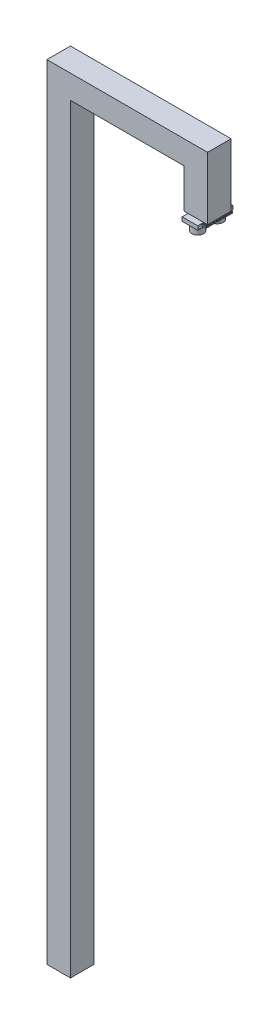
from build123d import *

# Parameters (mm, degrees)
SKETCH1_W           = 3
SKETCH1_H           = 3
BOSS_EXTRUDE1_DEPTH = 100
SKETCH3_W           = 3
SKETCH3_H           = 3
BOSS_EXTRUDE2_DEPTH = 17.5
SKETCH4_W           = 3
SKETCH4_H           = 3
BOSS_EXTRUDE3_DEPTH = 5
SKETCH5_W           = 2
SKETCH5_H           = 4.5
BOSS_EXTRUDE4_DEPTH = 0.5
SKETCH6_R           = 0.75
BOSS_EXTRUDE5_DEPTH = 1
SKETCH7_W           = 0.044871795
SKETCH7_H           = 0.25
BOSS_EXTRUDE6_DEPTH = 0.5


with BuildPart() as part:
    # Sketch1 → Boss-Extrude1 (new body)
    with BuildSketch(Plane(origin=(0, 0, 0), x_dir=(1, 0, 0), z_dir=(0, 1, 0))):
        Rectangle(SKETCH1_W, SKETCH1_H)
    extrude(amount=BOSS_EXTRUDE1_DEPTH)

    # Sketch3 → Boss-Extrude2 (add)
    with BuildSketch(Plane(origin=(1.5, 0, 0), x_dir=(0, 0, -1), z_dir=(1, 0, 0))):
        with Locations((0, 98.5)):
            Rectangle(SKETCH3_W, SKETCH3_H)
    extrude(amount=BOSS_EXTRUDE2_DEPTH)

    # Sketch4 → Boss-Extrude3 (add)
    with BuildSketch(Plane.XZ.offset(-97)):
        with Locations((17.5, 0)):
            Rectangle(SKETCH4_W, SKETCH4_H)
    extrude(amount=BOSS_EXTRUDE3_DEPTH)

    # Sketch5 → Boss-Extrude4 (add)
    with BuildSketch(Plane.XZ.offset(-92)):
        with Locations((17.5, 0)):
            Rectangle(SKETCH5_W, SKETCH5_H)
    extrude(amount=BOSS_EXTRUDE4_DEPTH)

    # Sketch6 → Boss-Extrude5 (add)
    with BuildSketch(Plane.XZ.offset(-91.5)):
        with Locations(Location((17.5, 1.25, 0), (0, 0, 270))):
            Circle(SKETCH6_R)
        with Locations(Location((17.5, -1.25, 0), (0, 0, 270))):
            Circle(SKETCH6_R)
    extrude(amount=BOSS_EXTRUDE5_DEPTH)

    # Sketch7 → Boss-Extrude6 (add)
    # profile 1 of 16: a face of its own
    with BuildSketch(Plane(origin=(18.5, 0, 0), x_dir=(0, 0, -1), z_dir=(1, 0, 0))):
        with BuildLine():
            Line((-1.72737139, 91.926101263), (-1.682499595, 91.926101263))
            Line((-1.682499595, 91.926101263), (-1.682499595, 91.763441007))
            add(Edge.make_bspline(
                [(-1.682499595, 91.763441007), (-1.682497155, 91.761754616), (-1.682492443, 91.758497369), (-1.682256525, 91.753824286), (-1.682040643, 91.749528745), (-1.681651132, 91.745615447), (-1.681075691, 91.74208272), (-1.680518476, 91.738907869), (-1.679764341, 91.736147738), (-1.678630997, 91.733005986), (-1.676884884, 91.729476056), (-1.674031834, 91.725797082), (-1.670739658, 91.722439484), (-1.666793796, 91.719644746), (-1.662358995, 91.717384056), (-1.657459624, 91.715709134), (-1.652102589, 91.7147781), (-1.648398493, 91.714635961), (-1.646491983, 91.714562801)],
                knots=[0, 0, 0, 0, 1.155499968, 2.231836252, 3.205919964, 4.102923608, 4.924856345, 5.658536265, 6.31071849, 6.882491295, 7.94666036, 8.992281882, 10.060072772, 11.158554251, 12.289267114, 13.461410017, 14.693379945, 16, 16, 16, 16], degree=3))
            add(Edge.make_bspline(
                [(-1.646491983, 91.714562801), (-1.644466552, 91.714621905), (-1.640517304, 91.714737147), (-1.634836939, 91.715868371), (-1.629574049, 91.717669667), (-1.624840067, 91.720240576), (-1.620639704, 91.723322261), (-1.617084185, 91.726836347), (-1.614278182, 91.730789844), (-1.612449333, 91.734437246), (-1.611422525, 91.737794362), (-1.610652881, 91.740793817), (-1.610088647, 91.744332878), (-1.609576755, 91.748356274), (-1.609269148, 91.752905679), (-1.608935598, 91.757944507), (-1.608813349, 91.763507235), (-1.608792512, 91.767380667), (-1.608781646, 91.769400542)],
                knots=[0, 0, 0, 0, 1.261321664, 2.459363699, 3.594844139, 4.716940403, 5.803436589, 6.833651888, 7.818396249, 8.814403945, 9.360733334, 10.004355033, 10.743453831, 11.592799886, 12.532235708, 13.585170094, 14.740740724, 16, 16, 16, 16], degree=3))
            Line((-1.608781646, 91.769400542), (-1.608781646, 91.926101263))
            Line((-1.608781646, 91.926101263), (-1.563909852, 91.926101263))
            Line((-1.563909852, 91.926101263), (-1.563909852, 91.776962641))
            add(Edge.make_bspline(
                [(-1.563909852, 91.776962641), (-1.563916083, 91.7739411), (-1.563928065, 91.768130971), (-1.564112074, 91.759781406), (-1.564503796, 91.752155418), (-1.564832798, 91.745250778), (-1.565469528, 91.739076789), (-1.566132852, 91.733607084), (-1.566978315, 91.728861049), (-1.568236314, 91.723458264), (-1.570407246, 91.717237156), (-1.573907075, 91.710073819), (-1.57834988, 91.703060478), (-1.583601055, 91.696274285), (-1.589530111, 91.689970131), (-1.596005589, 91.684435899), (-1.602924609, 91.679754536), (-1.610359471, 91.676040506), (-1.618303847, 91.673143843), (-1.626836341, 91.671197431), (-1.635951135, 91.669882411), (-1.642246895, 91.669756087), (-1.64549038, 91.669691007)],
                knots=[0, 0, 0, 0, 1.170808336, 2.251350247, 3.235597562, 4.129743112, 4.929140599, 5.639994148, 6.264258765, 6.79612947, 7.788252245, 8.809469599, 9.879094798, 10.999557536, 12.129761673, 13.226370002, 14.293821979, 15.358369427, 16.438775801, 17.562147481, 18.744053101, 20, 20, 20, 20], degree=3))
            add(Edge.make_bspline(
                [(-1.64549038, 91.669691007), (-1.647645417, 91.669727305), (-1.65189726, 91.669798922), (-1.658150341, 91.670430394), (-1.664195172, 91.671360946), (-1.670020394, 91.672718526), (-1.675646228, 91.674472266), (-1.681071176, 91.676630998), (-1.68627508, 91.67918268), (-1.691228819, 91.682103843), (-1.695926296, 91.685262578), (-1.700219548, 91.688764168), (-1.704256315, 91.692349658), (-1.707919977, 91.696169941), (-1.711238051, 91.70018491), (-1.714203704, 91.704403664), (-1.71681253, 91.708825829), (-1.719130151, 91.713531114), (-1.721113809, 91.718758671), (-1.722786107, 91.724694447), (-1.724247066, 91.731431479), (-1.725332765, 91.738984945), (-1.726317066, 91.74732995), (-1.726940074, 91.756488234), (-1.727265997, 91.76646006), (-1.727335371, 91.773373321), (-1.72737139, 91.776962641)],
                knots=[0, 0, 0, 0, 1.001158378, 1.975264943, 2.917723546, 3.841610987, 4.75185031, 5.653588123, 6.552117133, 7.442167995, 8.324307438, 9.179605724, 10.014504199, 10.831958861, 11.636465792, 12.43274043, 13.225645099, 14.020104002, 14.867201867, 15.819789774, 16.883317127, 18.068162734, 19.364263498, 20.787406516, 22.332041935, 24, 24, 24, 24], degree=3))
            Line((-1.72737139, 91.776962641), (-1.72737139, 91.926101263))
        make_face()
    # profile 2 of 16: a face of its own
    with BuildSketch(Plane(origin=(18.5, 0, 0), x_dir=(0, 0, -1), z_dir=(1, 0, 0))):
        Polygon((-1.506217544, 91.926101263), (-1.461345749, 91.926101263), (-1.461345749, 91.720973058), (-1.390832928, 91.720973058), (-1.390832928, 91.676101263), (-1.506217544, 91.676101263), align=None)
    # profile 3 of 16: a face of its own
    with BuildSketch(Plane(origin=(18.5, 0, 0), x_dir=(0, 0, -1), z_dir=(1, 0, 0))):
        Polygon((-1.378012416, 91.926101263), (-1.243397031, 91.926101263), (-1.243397031, 91.881229468), (-1.288268826, 91.881229468), (-1.288268826, 91.676101263), (-1.333140621, 91.676101263), (-1.333140621, 91.881229468), (-1.378012416, 91.881229468), align=None)
    # profile 4 of 16: a face of its own
    with BuildSketch(Plane(origin=(18.5, 0, 0), x_dir=(0, 0, -1), z_dir=(1, 0, 0))):
        with BuildLine():
            Line((-1.208140621, 91.926101263), (-1.155856967, 91.926101263))
            add(Edge.make_bspline(
                [(-1.155856967, 91.926101263), (-1.152401033, 91.926088996), (-1.1457543, 91.926065404), (-1.136170072, 91.925693184), (-1.127365642, 91.925175208), (-1.119327972, 91.924384763), (-1.112060501, 91.923336729), (-1.105555946, 91.922101271), (-1.099814497, 91.920693201), (-1.094787733, 91.918938635), (-1.090251326, 91.91695951), (-1.086022765, 91.91468546), (-1.08200876, 91.912141807), (-1.078236141, 91.90926162), (-1.074672123, 91.906096712), (-1.071309982, 91.902643899), (-1.068197228, 91.898873901), (-1.065353136, 91.894810541), (-1.062760976, 91.890535979), (-1.060470049, 91.886044346), (-1.058607064, 91.88133252), (-1.056960917, 91.876468595), (-1.055775251, 91.871383041), (-1.054950637, 91.866125367), (-1.054346887, 91.860677066), (-1.054312174, 91.856975732), (-1.054294467, 91.855087641)],
                knots=[0, 0, 0, 0, 1.749336639, 3.364467119, 4.854658419, 6.213483162, 7.451590619, 8.570285859, 9.5643256, 10.440900261, 11.26203566, 12.067320669, 12.869050712, 13.665104639, 14.467235401, 15.27997916, 16.102287765, 16.939272006, 17.78853747, 18.631303466, 19.488103222, 20.351255419, 21.228522269, 22.127379805, 23.044756219, 24, 24, 24, 24], degree=3))
            add(Edge.make_bspline(
                [(-1.054294467, 91.855087641), (-1.054340464, 91.853116908), (-1.054430657, 91.849252661), (-1.054916481, 91.843576396), (-1.055804417, 91.838145743), (-1.057149324, 91.832976602), (-1.05869512, 91.828004636), (-1.060750632, 91.823321583), (-1.063070481, 91.818859333), (-1.065825698, 91.814681008), (-1.068849414, 91.810693797), (-1.072365931, 91.807050465), (-1.076147435, 91.803555198), (-1.080406496, 91.800426928), (-1.084955372, 91.79745413), (-1.089884443, 91.794759985), (-1.095161542, 91.792276765), (-1.098871603, 91.790891951), (-1.100768826, 91.790183795)],
                knots=[0, 0, 0, 0, 1.099860209, 2.156625411, 3.176576793, 4.16617041, 5.135385252, 6.078461593, 7.016046972, 7.938469504, 8.868247731, 9.803980173, 10.76021508, 11.73834243, 12.748633912, 13.790971185, 14.870363756, 16, 16, 16, 16], degree=3))
            Line((-1.100768826, 91.790183795), (-1.043076518, 91.676101263))
            Line((-1.043076518, 91.676101263), (-1.092956326, 91.676101263))
            Line((-1.092956326, 91.676101263), (-1.148044467, 91.785075622))
            Line((-1.148044467, 91.785075622), (-1.163268826, 91.785075622))
            Line((-1.163268826, 91.785075622), (-1.163268826, 91.676101263))
            Line((-1.163268826, 91.676101263), (-1.208140621, 91.676101263))
            Line((-1.208140621, 91.676101263), (-1.208140621, 91.926101263))
        make_face()
        with BuildLine():
            Line((-1.163268826, 91.829947417), (-1.145790861, 91.829947417))
            add(Edge.make_bspline(
                [(-1.145790861, 91.829947417), (-1.143654035, 91.829971483), (-1.139562471, 91.830017565), (-1.133678265, 91.830231312), (-1.128334003, 91.830746337), (-1.123506735, 91.831397052), (-1.119172169, 91.832148396), (-1.11536897, 91.833225118), (-1.112038535, 91.834378853), (-1.10922033, 91.835812646), (-1.106812521, 91.83744318), (-1.104733531, 91.839295506), (-1.103013909, 91.841439339), (-1.101598572, 91.843816416), (-1.100497594, 91.846447764), (-1.099693965, 91.849304496), (-1.099244854, 91.852419154), (-1.099193183, 91.854568692), (-1.099166262, 91.855688603)],
                knots=[0, 0, 0, 0, 1.688639943, 3.233382647, 4.650958383, 5.928841754, 7.082724185, 8.122798841, 9.049171256, 9.863274652, 10.613301712, 11.341792392, 12.054588806, 12.776240173, 13.521029143, 14.301969904, 15.115324896, 16, 16, 16, 16], degree=3))
            add(Edge.make_bspline(
                [(-1.099166262, 91.855688603), (-1.099217158, 91.857013539), (-1.099317135, 91.859616132), (-1.100309217, 91.863362952), (-1.101888396, 91.86683089), (-1.104053018, 91.870004278), (-1.106779077, 91.872786289), (-1.109907446, 91.875238653), (-1.113505642, 91.8771778), (-1.1168373, 91.87845684), (-1.11986833, 91.879222103), (-1.12260374, 91.87979237), (-1.12577136, 91.880196535), (-1.129373583, 91.880625224), (-1.133401226, 91.880903207), (-1.137876242, 91.881106079), (-1.14278578, 91.881189084), (-1.146208194, 91.881215619), (-1.147994387, 91.881229468)],
                knots=[0, 0, 0, 0, 1.020303359, 2.004196876, 2.966617323, 3.9489082, 4.950758222, 5.960522915, 7.003732012, 8.091992268, 8.70421221, 9.413913587, 10.24622431, 11.166358409, 12.212345909, 13.359657661, 14.621978493, 16, 16, 16, 16], degree=3))
            Line((-1.147994387, 91.881229468), (-1.163268826, 91.881229468))
            Line((-1.163268826, 91.881229468), (-1.163268826, 91.829947417))
        make_face(mode=Mode.SUBTRACT)
    # profile 5 of 16: a face of its own
    with BuildSketch(Plane(origin=(18.5, 0, 0), x_dir=(0, 0, -1), z_dir=(1, 0, 0))):
        Polygon((-0.929244387, 91.926101263), (-0.8876278, 91.926101263), (-0.786666262, 91.676101263), (-0.834592945, 91.676101263), (-0.854024034, 91.727383314), (-0.962948313, 91.727383314), (-0.982379403, 91.676101263), (-1.030256005, 91.676101263), align=None)
        Polygon((-0.908461134, 91.859043971), (-0.94592107, 91.772255109), (-0.871001198, 91.772255109), align=None, mode=Mode.SUBTRACT)
    # profile 6 of 16: a face of its own
    with BuildSketch(Plane(origin=(18.5, 0, 0), x_dir=(0, 0, -1), z_dir=(1, 0, 0))):
        with BuildLine():
            Line((-0.621602159, 91.892697817), (-0.655155845, 91.861998699))
            add(Edge.make_bspline(
                [(-0.655155845, 91.861998699), (-0.656593141, 91.864026154), (-0.659352549, 91.867918586), (-0.663825262, 91.873130644), (-0.668277777, 91.877576917), (-0.672751347, 91.881238831), (-0.677285621, 91.884094138), (-0.68187273, 91.886115726), (-0.686486667, 91.887400869), (-0.689586521, 91.8875609), (-0.691113377, 91.887639725)],
                knots=[0, 0, 0, 0, 1.299362458, 2.494594718, 3.587462134, 4.587049575, 5.512617175, 6.380583204, 7.202344345, 8, 8, 8, 8], degree=3))
            add(Edge.make_bspline(
                [(-0.691113377, 91.887639725), (-0.692537585, 91.887589778), (-0.695287355, 91.887493343), (-0.699207356, 91.886534794), (-0.702687589, 91.884880479), (-0.705724657, 91.882717323), (-0.708130463, 91.880111221), (-0.710051313, 91.87737809), (-0.711132913, 91.874361332), (-0.711275272, 91.872289301), (-0.711345749, 91.871263523)],
                knots=[0, 0, 0, 0, 1.185010067, 2.2879431, 3.333075148, 4.379039566, 5.372662701, 6.27520591, 7.14612461, 8, 8, 8, 8], degree=3))
            add(Edge.make_bspline(
                [(-0.711345749, 91.871263523), (-0.711301585, 91.870222952), (-0.711212645, 91.868127388), (-0.710353602, 91.865056077), (-0.70905878, 91.862055049), (-0.707821524, 91.86022818), (-0.707189098, 91.859294372)],
                knots=[0, 0, 0, 0, 0.967525499, 1.948461899, 2.951351359, 4, 4, 4, 4], degree=3))
            add(Edge.make_bspline(
                [(-0.707189098, 91.859294372), (-0.706614155, 91.858568533), (-0.70529071, 91.856897746), (-0.702767172, 91.854251481), (-0.699598139, 91.851009574), (-0.695661658, 91.847283506), (-0.691121146, 91.842939272), (-0.685766141, 91.838147646), (-0.679750786, 91.832760237), (-0.675475211, 91.82900864), (-0.673234771, 91.827042769)],
                knots=[0, 0, 0, 0, 0.473873513, 1.090794244, 1.870441696, 2.795289791, 3.865433203, 5.087734844, 6.473946851, 8, 8, 8, 8], degree=3))
            add(Edge.make_bspline(
                [(-0.673234771, 91.827042769), (-0.671131796, 91.825222751), (-0.667140787, 91.821768733), (-0.661462372, 91.81686631), (-0.656471992, 91.812455719), (-0.652096947, 91.808603154), (-0.648403559, 91.805268193), (-0.6453763, 91.802434895), (-0.642978199, 91.80015842), (-0.641615019, 91.798783427), (-0.641033249, 91.798196616)],
                knots=[0, 0, 0, 0, 1.543621617, 2.929473131, 4.163658386, 5.240097082, 6.164993805, 6.925417477, 7.541396219, 8, 8, 8, 8], degree=3))
            add(Edge.make_bspline(
                [(-0.641033249, 91.798196616), (-0.638826136, 91.795808046), (-0.634583289, 91.791216378), (-0.629069084, 91.784100735), (-0.624530715, 91.777154417), (-0.621019747, 91.770246717), (-0.618368122, 91.763277972), (-0.616498692, 91.756077272), (-0.615379078, 91.748569375), (-0.615254774, 91.743446152), (-0.615191903, 91.740854869)],
                knots=[0, 0, 0, 0, 1.206664779, 2.319633467, 3.337109185, 4.282041471, 5.190008762, 6.099243693, 7.03861361, 8, 8, 8, 8], degree=3))
            add(Edge.make_bspline(
                [(-0.615191903, 91.740854869), (-0.615236653, 91.738329982), (-0.615324455, 91.733376059), (-0.61639986, 91.726126731), (-0.617933324, 91.719188809), (-0.620304329, 91.712637789), (-0.623194095, 91.706366136), (-0.626816835, 91.700471543), (-0.631071246, 91.694894355), (-0.635947454, 91.689734271), (-0.641341119, 91.685051852), (-0.647126337, 91.680883452), (-0.65335968, 91.677441907), (-0.65998789, 91.67460804), (-0.667007419, 91.672425358), (-0.674409906, 91.670812153), (-0.682206672, 91.669843932), (-0.687538213, 91.669742716), (-0.690262015, 91.669691007)],
                knots=[0, 0, 0, 0, 1.043214005, 2.046824704, 3.02475056, 3.976699089, 4.921714032, 5.875962561, 6.831408892, 7.817874052, 8.806269674, 9.781291748, 10.760897367, 11.74438705, 12.757449933, 13.795994037, 14.874007457, 16, 16, 16, 16], degree=3))
            add(Edge.make_bspline(
                [(-0.690262015, 91.669691007), (-0.692400176, 91.669728939), (-0.696634962, 91.669804067), (-0.702876396, 91.670417424), (-0.708903205, 91.671407317), (-0.714708602, 91.672826129), (-0.720318741, 91.674623956), (-0.725733853, 91.676819933), (-0.730916554, 91.679448097), (-0.735906059, 91.682454402), (-0.740678114, 91.685945119), (-0.74529306, 91.689848879), (-0.749705055, 91.694225726), (-0.753935291, 91.699065308), (-0.757956701, 91.70438133), (-0.761900919, 91.710099756), (-0.765592654, 91.716326712), (-0.767873203, 91.720694973), (-0.769038057, 91.722926183)],
                knots=[0, 0, 0, 0, 1.016823716, 2.013894106, 2.979844003, 3.91962641, 4.853723003, 5.779685073, 6.695824784, 7.614987388, 8.547259901, 9.504950863, 10.487499108, 11.500346958, 12.559593716, 13.656357062, 14.802919212, 16, 16, 16, 16], degree=3))
            Line((-0.769038057, 91.722926183), (-0.729574916, 91.746614084))
            add(Edge.make_bspline(
                [(-0.729574916, 91.746614084), (-0.728117858, 91.744081368), (-0.725324553, 91.739225937), (-0.720591038, 91.732702049), (-0.715741792, 91.727115419), (-0.710664708, 91.722564791), (-0.705421519, 91.718989317), (-0.699986899, 91.716434035), (-0.694357032, 91.714852318), (-0.690522222, 91.714659154), (-0.688609371, 91.714562801)],
                knots=[0, 0, 0, 0, 1.283663364, 2.460892379, 3.537111102, 4.529833553, 5.449777664, 6.316464042, 7.160231139, 8, 8, 8, 8], degree=3))
            add(Edge.make_bspline(
                [(-0.688609371, 91.714562801), (-0.686663727, 91.714641488), (-0.682888895, 91.714794152), (-0.677500805, 91.716204263), (-0.672560801, 91.71841824), (-0.668290697, 91.721577279), (-0.664675043, 91.725223292), (-0.662006482, 91.729279647), (-0.660330075, 91.733668525), (-0.660152838, 91.736717329), (-0.660063698, 91.738250702)],
                knots=[0, 0, 0, 0, 1.13588714, 2.203786484, 3.234766741, 4.283437687, 5.291419208, 6.222934724, 7.106237994, 8, 8, 8, 8], degree=3))
            add(Edge.make_bspline(
                [(-0.660063698, 91.738250702), (-0.660146015, 91.739677257), (-0.660313234, 91.742575166), (-0.661544921, 91.74688389), (-0.663470423, 91.751190655), (-0.665748428, 91.754723181), (-0.668066584, 91.757680868), (-0.670283263, 91.760243571), (-0.672982592, 91.763074908), (-0.676157726, 91.766178443), (-0.679766714, 91.769581495), (-0.683812596, 91.773283732), (-0.688341701, 91.777252541), (-0.691542881, 91.779956055), (-0.693216743, 91.781369692)],
                knots=[0, 0, 0, 0, 0.916159276, 1.861089862, 2.860218735, 3.940849679, 4.552606315, 5.27541173, 6.11797699, 7.06649574, 8.129236253, 9.306560635, 10.591630461, 12, 12, 12, 12], degree=3))
            add(Edge.make_bspline(
                [(-0.693216743, 91.781369692), (-0.69639882, 91.784062035), (-0.70250619, 91.789229456), (-0.711136679, 91.796861574), (-0.718913522, 91.803994487), (-0.72576955, 91.810716374), (-0.73179212, 91.816903098), (-0.736940444, 91.822604909), (-0.741157966, 91.827865789), (-0.745595998, 91.834096949), (-0.749813016, 91.841690046), (-0.753457716, 91.850825422), (-0.755822243, 91.859959638), (-0.756087156, 91.866091848), (-0.756217544, 91.869110077)],
                knots=[0, 0, 0, 0, 1.345494975, 2.582412109, 3.71882943, 4.751509156, 5.681369928, 6.505683931, 7.230279997, 7.856715994, 8.973648664, 10.023341002, 11.027102913, 12, 12, 12, 12], degree=3))
            add(Edge.make_bspline(
                [(-0.756217544, 91.869110077), (-0.756163316, 91.871250443), (-0.75605648, 91.875467194), (-0.755103493, 91.881667311), (-0.753679216, 91.887649904), (-0.751610758, 91.893393144), (-0.748926149, 91.898889838), (-0.745665796, 91.904166895), (-0.741779071, 91.909175746), (-0.737398995, 91.91391307), (-0.732573272, 91.918242445), (-0.727416374, 91.922063552), (-0.721957489, 91.925290915), (-0.716230012, 91.927968247), (-0.710198452, 91.930017575), (-0.703907244, 91.93147024), (-0.697347363, 91.932334239), (-0.692885474, 91.93245169), (-0.690612576, 91.932511519)],
                knots=[0, 0, 0, 0, 1.010766082, 1.991317756, 2.957454644, 3.913069143, 4.869106762, 5.843196583, 6.838735724, 7.860187025, 8.887984031, 9.89767229, 10.887916223, 11.879572884, 12.879850636, 13.892031539, 14.926195476, 16, 16, 16, 16], degree=3))
            add(Edge.make_bspline(
                [(-0.690612576, 91.932511519), (-0.687667013, 91.932403764), (-0.681799138, 91.932189105), (-0.673123316, 91.930510539), (-0.664649135, 91.927870817), (-0.657820482, 91.924686283), (-0.65238705, 91.921601423), (-0.648222832, 91.918761273), (-0.643985516, 91.915507728), (-0.639640931, 91.911830536), (-0.635269805, 91.907660414), (-0.630747847, 91.903096634), (-0.626136675, 91.898099755), (-0.623140144, 91.894530008), (-0.621602159, 91.892697817)],
                knots=[0, 0, 0, 0, 1.282922637, 2.555718331, 3.837320111, 5.142675274, 5.830281639, 6.55870424, 7.337177975, 8.157850921, 9.037902056, 9.96903443, 10.957596896, 12, 12, 12, 12], degree=3))
        make_face()
    # profile 7 of 16: a face of its own
    with BuildSketch(Plane(origin=(18.5, 0, 0), x_dir=(0, 0, -1), z_dir=(1, 0, 0))):
        with BuildLine():
            add(Edge.make_bspline(
                [(-0.452832127, 91.932511519), (-0.448485571, 91.932398979), (-0.439904484, 91.9321768), (-0.427284802, 91.930324758), (-0.415123405, 91.927307123), (-0.403425792, 91.923112391), (-0.392221253, 91.917626948), (-0.381470266, 91.91100631), (-0.37121134, 91.903125517), (-0.361549601, 91.894168415), (-0.352620411, 91.884427957), (-0.344883263, 91.873940622), (-0.338285307, 91.862978147), (-0.332816903, 91.85151116), (-0.328651696, 91.839460244), (-0.325728798, 91.826886843), (-0.32385098, 91.813794536), (-0.323635003, 91.804880459), (-0.323525236, 91.800350061)],
                knots=[0, 0, 0, 0, 1.014329547, 2.002516266, 2.970391464, 3.935626869, 4.897733899, 5.877609409, 6.878433252, 7.912639331, 8.949961323, 9.958554974, 10.949718813, 11.932905612, 12.9188844, 13.919928257, 14.942845884, 16, 16, 16, 16], degree=3))
            add(Edge.make_bspline(
                [(-0.323525236, 91.800350061), (-0.323642133, 91.79587071), (-0.323872481, 91.787044005), (-0.325652137, 91.774072349), (-0.328624257, 91.761633636), (-0.332718819, 91.749699711), (-0.338088047, 91.738328379), (-0.344557335, 91.727447035), (-0.352297398, 91.717156661), (-0.361025923, 91.707462778), (-0.370635272, 91.698663499), (-0.380813098, 91.690909149), (-0.391512406, 91.684338406), (-0.402717536, 91.678954279), (-0.414452516, 91.674775857), (-0.426688361, 91.671827676), (-0.439424311, 91.670036007), (-0.448085376, 91.669807163), (-0.452481566, 91.669691007)],
                knots=[0, 0, 0, 0, 1.051557043, 2.072126891, 3.067553643, 4.050577992, 5.02905126, 6.015227836, 7.017913613, 8.04756643, 9.074058332, 10.072836633, 11.047628519, 12.017157415, 12.98668631, 13.966869689, 14.968021931, 16, 16, 16, 16], degree=3))
            add(Edge.make_bspline(
                [(-0.452481566, 91.669691007), (-0.457079455, 91.669795205), (-0.466113676, 91.66999994), (-0.479335301, 91.671946879), (-0.492002759, 91.674879648), (-0.504009638, 91.679256649), (-0.515478217, 91.684728269), (-0.526324232, 91.691466896), (-0.53654404, 91.699461396), (-0.546079018, 91.708507025), (-0.554717731, 91.718404927), (-0.562343089, 91.728861183), (-0.568775248, 91.739795916), (-0.574014443, 91.751214244), (-0.578144814, 91.763045205), (-0.581058321, 91.775360852), (-0.5827794, 91.788131649), (-0.583019136, 91.796805829), (-0.583140621, 91.801201423)],
                knots=[0, 0, 0, 0, 1.067978421, 2.098431617, 3.099715153, 4.085208694, 5.062210972, 6.048429807, 7.046490867, 8.072918869, 9.098532598, 10.095778865, 11.076610158, 12.041847152, 13.011192615, 13.984257998, 14.978533688, 16, 16, 16, 16], degree=3))
            add(Edge.make_bspline(
                [(-0.583140621, 91.801201423), (-0.583102492, 91.804158549), (-0.583026717, 91.810035355), (-0.582113925, 91.818744483), (-0.580799766, 91.82728362), (-0.578856189, 91.835618721), (-0.576495239, 91.843808587), (-0.573436295, 91.851776983), (-0.569954388, 91.859609034), (-0.565886109, 91.867212234), (-0.561362575, 91.874516627), (-0.556426997, 91.881487757), (-0.551066964, 91.888041333), (-0.545299743, 91.894220422), (-0.539105459, 91.899984409), (-0.532565592, 91.905414891), (-0.525553305, 91.910367615), (-0.518222077, 91.914963536), (-0.510613239, 91.919119548), (-0.502757765, 91.922657021), (-0.494817494, 91.925746235), (-0.486686355, 91.92818438), (-0.478451488, 91.930170224), (-0.470024918, 91.931483496), (-0.461482777, 91.932396263), (-0.45572252, 91.932473009), (-0.452832127, 91.932511519)],
                knots=[0, 0, 0, 0, 1.034744296, 2.056386356, 3.06226378, 4.057406941, 5.050368692, 6.043467995, 7.042652155, 8.049140477, 9.059438543, 10.048523776, 11.036952808, 12.020949711, 13.004946614, 13.997082645, 14.994316842, 16.007702937, 17.024872941, 18.026463647, 19.021641123, 20.005082605, 20.995858141, 21.984425357, 22.988620895, 24, 24, 24, 24], degree=3))
        make_face()
        with BuildLine():
            add(Edge.make_bspline(
                [(-0.453533249, 91.887639725), (-0.456458481, 91.887561234), (-0.462231718, 91.887406325), (-0.470700006, 91.886226129), (-0.478829861, 91.884341221), (-0.486576216, 91.881610955), (-0.493972646, 91.878136019), (-0.501032261, 91.873928556), (-0.5076573, 91.868843938), (-0.513936103, 91.863155136), (-0.519607968, 91.856816502), (-0.524619239, 91.850023579), (-0.528812866, 91.84278771), (-0.532325055, 91.835176113), (-0.534968955, 91.8271032), (-0.536852126, 91.818632206), (-0.538042219, 91.809748534), (-0.538192232, 91.803692547), (-0.538268826, 91.800600462)],
                knots=[0, 0, 0, 0, 1.033739768, 2.040188636, 3.016340934, 3.979330865, 4.937572243, 5.900995986, 6.878200029, 7.884839167, 8.891893314, 9.879764717, 10.863503415, 11.843163062, 12.837761627, 13.859916423, 14.907309254, 16, 16, 16, 16], degree=3))
            add(Edge.make_bspline(
                [(-0.538268826, 91.800600462), (-0.538167274, 91.797173736), (-0.537968249, 91.79045792), (-0.536567885, 91.780661069), (-0.534172001, 91.771408916), (-0.530712392, 91.762746711), (-0.526421569, 91.754578268), (-0.521093047, 91.747003701), (-0.514813125, 91.739977659), (-0.509975123, 91.735875563), (-0.507519627, 91.733793571)],
                knots=[0, 0, 0, 0, 1.078454662, 2.113592447, 3.107694534, 4.079536787, 5.043276885, 6.005368276, 6.987637804, 8, 8, 8, 8], degree=3))
            add(Edge.make_bspline(
                [(-0.507519627, 91.733793571), (-0.505508107, 91.732255475), (-0.501530387, 91.729213937), (-0.49518108, 91.725315583), (-0.488642544, 91.721974304), (-0.481865438, 91.71927459), (-0.474864074, 91.717151041), (-0.467639413, 91.715663954), (-0.460201691, 91.714730678), (-0.455171955, 91.714619134), (-0.452631807, 91.714562801)],
                knots=[0, 0, 0, 0, 1.023928204, 2.024787132, 3.009472467, 3.9914905, 4.972207045, 5.96565515, 6.972602802, 8, 8, 8, 8], degree=3))
            add(Edge.make_bspline(
                [(-0.452631807, 91.714562801), (-0.449756874, 91.714641958), (-0.444100354, 91.7147977), (-0.435789708, 91.715963367), (-0.427827857, 91.717936097), (-0.420165373, 91.720642413), (-0.412824351, 91.724160979), (-0.405840669, 91.728498945), (-0.399202081, 91.733603045), (-0.392931278, 91.739366554), (-0.387199467, 91.745730157), (-0.382198653, 91.752559313), (-0.37787169, 91.759703555), (-0.374432537, 91.767264), (-0.371684183, 91.77516928), (-0.369823677, 91.783454407), (-0.36862353, 91.792085225), (-0.368473475, 91.797958801), (-0.368397031, 91.800951023)],
                knots=[0, 0, 0, 0, 1.026359118, 2.019393844, 2.989460624, 3.950973911, 4.916101784, 5.890408035, 6.881132271, 7.902007068, 8.92769091, 9.933912415, 10.920395702, 11.90457117, 12.894218921, 13.903490204, 14.931958862, 16, 16, 16, 16], degree=3))
            add(Edge.make_bspline(
                [(-0.368397031, 91.800951023), (-0.36847612, 91.803926038), (-0.368631794, 91.809781902), (-0.369799513, 91.81839053), (-0.371759733, 91.82663908), (-0.374474175, 91.834541022), (-0.377940373, 91.842104104), (-0.382226679, 91.849301728), (-0.387318053, 91.856126938), (-0.393097316, 91.862533221), (-0.399387689, 91.868420185), (-0.406141033, 91.873528999), (-0.413168382, 91.877968396), (-0.420630977, 91.881446041), (-0.42837614, 91.884216673), (-0.436451133, 91.886257006), (-0.44488654, 91.887398034), (-0.450625321, 91.887558443), (-0.453533249, 91.887639725)],
                knots=[0, 0, 0, 0, 1.055025985, 2.07665775, 3.074803781, 4.057872707, 5.035505728, 6.020516407, 7.023567878, 8.050795229, 9.077271434, 10.074415901, 11.050397877, 12.019801805, 12.988065821, 13.964604439, 14.968634123, 16, 16, 16, 16], degree=3))
        make_face(mode=Mode.SUBTRACT)
    # profile 8 of 16: a face of its own
    with BuildSketch(Plane(origin=(18.5, 0, 0), x_dir=(0, 0, -1), z_dir=(1, 0, 0))):
        Polygon((-0.278653441, 91.926101263), (-0.238238778, 91.926101263), (-0.124807287, 91.761588042), (-0.124807287, 91.926101263), (-0.079935493, 91.926101263), (-0.079935493, 91.676101263), (-0.120650637, 91.676101263), (-0.233781646, 91.840113683), (-0.233781646, 91.676101263), (-0.278653441, 91.676101263), align=None)
    # profile 9 of 16: a face of its own
    with BuildSketch(Plane(origin=(18.5, 0, 0), x_dir=(0, 0, -1), z_dir=(1, 0, 0))):
        with Locations((-0.006217544, 91.801101263)):
            Rectangle(SKETCH7_W, SKETCH7_H)
    # profile 10 of 16: a face of its own
    with BuildSketch(Plane(origin=(18.5, 0, 0), x_dir=(0, 0, -1), z_dir=(1, 0, 0))):
        with BuildLine():
            Line((0.298269636, 91.882731872), (0.265366991, 91.851281551))
            add(Edge.make_bspline(
                [(0.265366991, 91.851281551), (0.262575921, 91.854167523), (0.257124086, 91.859804729), (0.248339129, 91.867267894), (0.239203093, 91.873487431), (0.229893702, 91.878725486), (0.220243507, 91.882688448), (0.21036409, 91.885576325), (0.200192369, 91.887336955), (0.193308539, 91.887538402), (0.189846158, 91.887639725)],
                knots=[0, 0, 0, 0, 1.115251505, 2.178435587, 3.19620269, 4.182487026, 5.141301733, 6.088180966, 7.038406374, 8, 8, 8, 8], degree=3))
            add(Edge.make_bspline(
                [(0.189846158, 91.887639725), (0.186954649, 91.887559676), (0.181248574, 91.88740171), (0.172870561, 91.886243659), (0.164856558, 91.884274343), (0.157179133, 91.881560261), (0.149860876, 91.878048384), (0.142886444, 91.873741428), (0.136273033, 91.868678293), (0.130108, 91.862885174), (0.124468446, 91.856555756), (0.11948554, 91.849802283), (0.115311557, 91.842640226), (0.111886037, 91.835142116), (0.109217689, 91.82727325), (0.107312154, 91.819038924), (0.106210043, 91.810429333), (0.106045546, 91.804576597), (0.105961943, 91.801602064)],
                knots=[0, 0, 0, 0, 1.035432265, 2.043311493, 3.022114605, 3.98653278, 4.95457646, 5.923598177, 6.917315552, 7.932509744, 8.948865224, 9.949768934, 10.933144597, 11.912367597, 12.897413939, 13.903909035, 14.934704909, 16, 16, 16, 16], degree=3))
            add(Edge.make_bspline(
                [(0.105961943, 91.801602064), (0.105986037, 91.799514329), (0.106033525, 91.79539936), (0.106553369, 91.789312179), (0.107390439, 91.783406175), (0.108601888, 91.777690292), (0.110116817, 91.772159579), (0.111894174, 91.766766322), (0.114123841, 91.761585042), (0.116598806, 91.756555565), (0.119477161, 91.751815123), (0.122580559, 91.74729472), (0.125945688, 91.743016511), (0.129594343, 91.738997988), (0.133577875, 91.73530195), (0.137793324, 91.731817254), (0.142311799, 91.728631133), (0.14703944, 91.725663628), (0.152017088, 91.723085731), (0.157109688, 91.720750654), (0.162394453, 91.718854225), (0.167807039, 91.71732553), (0.173328103, 91.716025603), (0.179011646, 91.715225198), (0.184808398, 91.714619061), (0.18872603, 91.714581635), (0.19069752, 91.714562801)],
                knots=[0, 0, 0, 0, 1.103660481, 2.175337485, 3.227646561, 4.255952547, 5.262355991, 6.258840057, 7.255597736, 8.242457506, 9.22035537, 10.185017736, 11.140346927, 12.096287581, 13.051739095, 14.01125915, 14.986044842, 15.97314143, 16.960198552, 17.947847494, 18.933482797, 19.925264591, 20.920966487, 21.929612487, 22.958107872, 24, 24, 24, 24], degree=3))
            add(Edge.make_bspline(
                [(0.19069752, 91.714562801), (0.194041507, 91.714659527), (0.200611572, 91.714849568), (0.210254087, 91.716335663), (0.219442442, 91.718780205), (0.226783895, 91.721667067), (0.232535729, 91.72451788), (0.236914515, 91.727154743), (0.241442521, 91.730104362), (0.246044541, 91.733478062), (0.250772338, 91.737235355), (0.255542456, 91.741458534), (0.260477011, 91.746008535), (0.263709589, 91.74925596), (0.265366991, 91.750920975)],
                knots=[0, 0, 0, 0, 1.404581149, 2.759636711, 4.088442092, 5.392261763, 6.066678138, 6.783632037, 7.538459478, 8.336747902, 9.180226004, 10.074962426, 11.012997595, 12, 12, 12, 12], degree=3))
            Line((0.265366991, 91.750920975), (0.297268033, 91.717417369))
            add(Edge.make_bspline(
                [(0.297268033, 91.717417369), (0.295025562, 91.715252333), (0.290648737, 91.711026646), (0.284046418, 91.705026565), (0.277452408, 91.699634825), (0.271026006, 91.69465573), (0.264661939, 91.690234332), (0.258360882, 91.686366217), (0.252194167, 91.682953554), (0.246033739, 91.680053895), (0.239841265, 91.677591784), (0.233469938, 91.675472068), (0.226900278, 91.673678864), (0.220092162, 91.672231984), (0.213109092, 91.671071782), (0.205885715, 91.670288652), (0.198467832, 91.66976218), (0.193436167, 91.669714872), (0.190897841, 91.669691007)],
                knots=[0, 0, 0, 0, 1.244526981, 2.429050516, 3.560637417, 4.644440555, 5.67424972, 6.652764056, 7.595344123, 8.486817594, 9.369275933, 10.254498637, 11.166417451, 12.086725134, 13.032340136, 13.991389299, 14.986715468, 16, 16, 16, 16], degree=3))
            add(Edge.make_bspline(
                [(0.190897841, 91.669691007), (0.18623525, 91.669809865), (0.177111857, 91.670042439), (0.163741763, 91.671765651), (0.151040531, 91.674654586), (0.138977264, 91.678740336), (0.127555797, 91.683959691), (0.116779051, 91.690358374), (0.106664397, 91.697919387), (0.09729354, 91.706554106), (0.088817155, 91.716090428), (0.081325012, 91.726329822), (0.07512751, 91.737322611), (0.069981592, 91.748906395), (0.065957551, 91.761134036), (0.063125308, 91.774018762), (0.061378685, 91.78754813), (0.061187602, 91.796789), (0.061090148, 91.801501904)],
                knots=[0, 0, 0, 0, 1.078019885, 2.10938526, 3.111377082, 4.085535484, 5.04941344, 6.010039228, 6.978205633, 7.964457913, 8.951525778, 9.924444315, 10.892603023, 11.863865945, 12.85144698, 13.863884204, 14.910567087, 16, 16, 16, 16], degree=3))
            add(Edge.make_bspline(
                [(0.061090148, 91.801501904), (0.061131328, 91.80457562), (0.061212935, 91.810666973), (0.062070632, 91.81964003), (0.063266313, 91.828387155), (0.065163151, 91.836817525), (0.067449602, 91.845044711), (0.070293105, 91.852979295), (0.073689118, 91.860644081), (0.077528179, 91.8680519), (0.08187127, 91.875154223), (0.08672298, 91.88189003), (0.091958406, 91.88831132), (0.097703348, 91.894332903), (0.103874324, 91.900007649), (0.110499194, 91.905304806), (0.117538114, 91.910300342), (0.125010136, 91.914865433), (0.132770097, 91.9189948), (0.140720126, 91.922637078), (0.148840688, 91.925681184), (0.15709745, 91.928206157), (0.165525296, 91.930090872), (0.174064071, 91.931517539), (0.18278643, 91.932315056), (0.188642738, 91.932445614), (0.191598963, 91.932511519)],
                knots=[0, 0, 0, 0, 1.071919942, 2.124283339, 3.142214191, 4.149696895, 5.136002878, 6.119640489, 7.086990633, 8.058538607, 9.028339693, 9.988281803, 10.952401235, 11.916291999, 12.888973767, 13.874849856, 14.873389453, 15.898127285, 16.927174885, 17.938320013, 18.946391617, 19.950418109, 20.947802303, 21.956882652, 22.968648068, 24, 24, 24, 24], degree=3))
            add(Edge.make_bspline(
                [(0.191598963, 91.932511519), (0.194120926, 91.932473741), (0.19913863, 91.932398577), (0.206610834, 91.931772003), (0.214023279, 91.930787974), (0.221349426, 91.929303284), (0.22864168, 91.92754077), (0.23580421, 91.925233001), (0.242950012, 91.922660557), (0.249967012, 91.919585726), (0.256865006, 91.91622927), (0.263482398, 91.912421248), (0.269930293, 91.908396003), (0.27606581, 91.903915303), (0.282003879, 91.89914167), (0.28771345, 91.894052833), (0.293144419, 91.888563947), (0.296552593, 91.884685725), (0.298269636, 91.882731872)],
                knots=[0, 0, 0, 0, 0.996412454, 1.982464992, 2.961075852, 3.949442424, 4.934965278, 5.923860011, 6.921385422, 7.934793307, 8.949617135, 9.951082467, 10.950285876, 11.951772932, 12.951063433, 13.960125323, 14.972308753, 16, 16, 16, 16], degree=3))
        make_face()
    # profile 11 of 16: a face of its own
    with BuildSketch(Plane(origin=(18.5, 0, 0), x_dir=(0, 0, -1), z_dir=(1, 0, 0))):
        with BuildLine():
            Line((0.567500405, 91.892697817), (0.533946719, 91.861998699))
            add(Edge.make_bspline(
                [(0.533946719, 91.861998699), (0.532509423, 91.864026154), (0.529750015, 91.867918586), (0.525277303, 91.873130644), (0.520824787, 91.877576917), (0.516351218, 91.881238831), (0.511816943, 91.884094138), (0.507229834, 91.886115726), (0.502615897, 91.887400869), (0.499516043, 91.8875609), (0.497989187, 91.887639725)],
                knots=[0, 0, 0, 0, 1.299362458, 2.494594718, 3.587462134, 4.587049575, 5.512617175, 6.380583204, 7.202344345, 8, 8, 8, 8], degree=3))
            add(Edge.make_bspline(
                [(0.497989187, 91.887639725), (0.49656498, 91.887589778), (0.493815209, 91.887493343), (0.489895208, 91.886534794), (0.486414975, 91.884880479), (0.483377907, 91.882717323), (0.480972101, 91.880111221), (0.479051251, 91.87737809), (0.477969651, 91.874361332), (0.477827292, 91.872289301), (0.477756815, 91.871263523)],
                knots=[0, 0, 0, 0, 1.185010067, 2.2879431, 3.333075148, 4.379039566, 5.372662701, 6.27520591, 7.14612461, 8, 8, 8, 8], degree=3))
            add(Edge.make_bspline(
                [(0.477756815, 91.871263523), (0.477800979, 91.870222952), (0.47788992, 91.868127388), (0.478748962, 91.865056077), (0.480043784, 91.862055049), (0.48128104, 91.86022818), (0.481913466, 91.859294372)],
                knots=[0, 0, 0, 0, 0.967525499, 1.948461899, 2.951351359, 4, 4, 4, 4], degree=3))
            add(Edge.make_bspline(
                [(0.481913466, 91.859294372), (0.48248841, 91.858568533), (0.483811854, 91.856897746), (0.486335392, 91.854251481), (0.489504425, 91.851009574), (0.493440906, 91.847283506), (0.497981419, 91.842939272), (0.503336423, 91.838147646), (0.509351778, 91.832760237), (0.513627353, 91.82900864), (0.515867793, 91.827042769)],
                knots=[0, 0, 0, 0, 0.473873513, 1.090794244, 1.870441696, 2.795289791, 3.865433203, 5.087734844, 6.473946851, 8, 8, 8, 8], degree=3))
            add(Edge.make_bspline(
                [(0.515867793, 91.827042769), (0.517970768, 91.825222751), (0.521961777, 91.821768733), (0.527640192, 91.81686631), (0.532630572, 91.812455719), (0.537005617, 91.808603154), (0.540699005, 91.805268193), (0.543726264, 91.802434895), (0.546124365, 91.80015842), (0.547487545, 91.798783427), (0.548069315, 91.798196616)],
                knots=[0, 0, 0, 0, 1.543621617, 2.929473131, 4.163658386, 5.240097082, 6.164993805, 6.925417477, 7.541396219, 8, 8, 8, 8], degree=3))
            add(Edge.make_bspline(
                [(0.548069315, 91.798196616), (0.550276428, 91.795808046), (0.554519275, 91.791216378), (0.56003348, 91.784100735), (0.564571849, 91.777154417), (0.568082817, 91.770246717), (0.570734442, 91.763277972), (0.572603872, 91.756077272), (0.573723486, 91.748569375), (0.57384779, 91.743446152), (0.573910661, 91.740854869)],
                knots=[0, 0, 0, 0, 1.206664779, 2.319633467, 3.337109185, 4.282041471, 5.190008762, 6.099243693, 7.03861361, 8, 8, 8, 8], degree=3))
            add(Edge.make_bspline(
                [(0.573910661, 91.740854869), (0.573865911, 91.738329982), (0.573778109, 91.733376059), (0.572702704, 91.726126731), (0.57116924, 91.719188809), (0.568798235, 91.712637789), (0.565908469, 91.706366136), (0.562285729, 91.700471543), (0.558031319, 91.694894355), (0.553155111, 91.689734271), (0.547761445, 91.685051852), (0.541976227, 91.680883452), (0.535742884, 91.677441907), (0.529114674, 91.67460804), (0.522095145, 91.672425358), (0.514692658, 91.670812153), (0.506895892, 91.669843932), (0.501564351, 91.669742716), (0.498840549, 91.669691007)],
                knots=[0, 0, 0, 0, 1.043214005, 2.046824704, 3.02475056, 3.976699089, 4.921714032, 5.875962561, 6.831408892, 7.817874052, 8.806269674, 9.781291748, 10.760897367, 11.74438705, 12.757449933, 13.795994037, 14.874007457, 16, 16, 16, 16], degree=3))
            add(Edge.make_bspline(
                [(0.498840549, 91.669691007), (0.496702388, 91.669728939), (0.492467602, 91.669804067), (0.486226169, 91.670417424), (0.480199359, 91.671407317), (0.474393962, 91.672826129), (0.468783823, 91.674623956), (0.463368712, 91.676819933), (0.458186011, 91.679448097), (0.453196505, 91.682454402), (0.44842445, 91.685945119), (0.443809504, 91.689848879), (0.439397509, 91.694225726), (0.435167273, 91.699065308), (0.431145864, 91.70438133), (0.427201645, 91.710099756), (0.42350991, 91.716326712), (0.421229361, 91.720694973), (0.420064507, 91.722926183)],
                knots=[0, 0, 0, 0, 1.016823716, 2.013894106, 2.979844003, 3.91962641, 4.853723003, 5.779685073, 6.695824784, 7.614987388, 8.547259901, 9.504950863, 10.487499108, 11.500346958, 12.559593716, 13.656357062, 14.802919212, 16, 16, 16, 16], degree=3))
            Line((0.420064507, 91.722926183), (0.459527648, 91.746614084))
            add(Edge.make_bspline(
                [(0.459527648, 91.746614084), (0.460984706, 91.744081368), (0.463778011, 91.739225937), (0.468511527, 91.732702049), (0.473360772, 91.727115419), (0.478437856, 91.722564791), (0.483681046, 91.718989317), (0.489115665, 91.716434035), (0.494745532, 91.714852318), (0.498580342, 91.714659154), (0.500493193, 91.714562801)],
                knots=[0, 0, 0, 0, 1.283663364, 2.460892379, 3.537111102, 4.529833553, 5.449777664, 6.316464042, 7.160231139, 8, 8, 8, 8], degree=3))
            add(Edge.make_bspline(
                [(0.500493193, 91.714562801), (0.502438837, 91.714641488), (0.506213669, 91.714794152), (0.511601759, 91.716204263), (0.516541763, 91.71841824), (0.520811867, 91.721577279), (0.524427521, 91.725223292), (0.527096082, 91.729279647), (0.528772489, 91.733668525), (0.528949726, 91.736717329), (0.529038866, 91.738250702)],
                knots=[0, 0, 0, 0, 1.13588714, 2.203786484, 3.234766741, 4.283437687, 5.291419208, 6.222934724, 7.106237994, 8, 8, 8, 8], degree=3))
            add(Edge.make_bspline(
                [(0.529038866, 91.738250702), (0.528956549, 91.739677257), (0.52878933, 91.742575166), (0.527557643, 91.74688389), (0.525632141, 91.751190655), (0.523354136, 91.754723181), (0.521035981, 91.757680868), (0.518819301, 91.760243571), (0.516119972, 91.763074908), (0.512944838, 91.766178443), (0.50933585, 91.769581495), (0.505289968, 91.773283732), (0.500760863, 91.777252541), (0.497559683, 91.779956055), (0.495885822, 91.781369692)],
                knots=[0, 0, 0, 0, 0.916159276, 1.861089862, 2.860218735, 3.940849679, 4.552606315, 5.27541173, 6.11797699, 7.06649574, 8.129236253, 9.306560635, 10.591630461, 12, 12, 12, 12], degree=3))
            add(Edge.make_bspline(
                [(0.495885822, 91.781369692), (0.492703744, 91.784062035), (0.486596374, 91.789229456), (0.477965885, 91.796861574), (0.470189042, 91.803994487), (0.463333014, 91.810716374), (0.457310444, 91.816903098), (0.45216212, 91.822604909), (0.447944598, 91.827865789), (0.443506566, 91.834096949), (0.439289548, 91.841690046), (0.435644848, 91.850825422), (0.433280321, 91.859959638), (0.433015408, 91.866091848), (0.43288502, 91.869110077)],
                knots=[0, 0, 0, 0, 1.345494975, 2.582412109, 3.71882943, 4.751509156, 5.681369928, 6.505683931, 7.230279997, 7.856715994, 8.973648664, 10.023341002, 11.027102913, 12, 12, 12, 12], degree=3))
            add(Edge.make_bspline(
                [(0.43288502, 91.869110077), (0.432939248, 91.871250443), (0.433046084, 91.875467194), (0.433999071, 91.881667311), (0.435423348, 91.887649904), (0.437491806, 91.893393144), (0.440176415, 91.898889838), (0.443436768, 91.904166895), (0.447323493, 91.909175746), (0.45170357, 91.91391307), (0.456529292, 91.918242445), (0.46168619, 91.922063552), (0.467145075, 91.925290915), (0.472872552, 91.927968247), (0.478904112, 91.930017575), (0.48519532, 91.93147024), (0.491755201, 91.932334239), (0.49621709, 91.93245169), (0.498489988, 91.932511519)],
                knots=[0, 0, 0, 0, 1.010766082, 1.991317756, 2.957454644, 3.913069143, 4.869106762, 5.843196583, 6.838735724, 7.860187025, 8.887984031, 9.89767229, 10.887916223, 11.879572884, 12.879850636, 13.892031539, 14.926195476, 16, 16, 16, 16], degree=3))
            add(Edge.make_bspline(
                [(0.498489988, 91.932511519), (0.501435551, 91.932403764), (0.507303426, 91.932189105), (0.515979248, 91.930510539), (0.524453429, 91.927870817), (0.531282082, 91.924686283), (0.536715514, 91.921601423), (0.540879732, 91.918761273), (0.545117048, 91.915507728), (0.549461634, 91.911830536), (0.553832759, 91.907660414), (0.558354717, 91.903096634), (0.562965889, 91.898099755), (0.56596242, 91.894530008), (0.567500405, 91.892697817)],
                knots=[0, 0, 0, 0, 1.282922637, 2.555718331, 3.837320111, 5.142675274, 5.830281639, 6.55870424, 7.337177975, 8.157850921, 9.037902056, 9.96903443, 10.957596896, 12, 12, 12, 12], degree=3))
        make_face()
    # profile 12 of 16: a face of its own
    with BuildSketch(Plane(origin=(18.5, 0, 0), x_dir=(0, 0, -1), z_dir=(1, 0, 0))):
        Polygon((0.618782456, 91.926101263), (0.753397841, 91.926101263), (0.753397841, 91.881229468), (0.663654251, 91.881229468), (0.663654251, 91.833152545), (0.753397841, 91.833152545), (0.753397841, 91.78828075), (0.663654251, 91.78828075), (0.663654251, 91.720973058), (0.753397841, 91.720973058), (0.753397841, 91.676101263), (0.618782456, 91.676101263), align=None)
    # profile 13 of 16: a face of its own
    with BuildSketch(Plane(origin=(18.5, 0, 0), x_dir=(0, 0, -1), z_dir=(1, 0, 0))):
        Polygon((0.798269636, 91.926101263), (0.838684299, 91.926101263), (0.952115789, 91.761588042), (0.952115789, 91.926101263), (0.996987584, 91.926101263), (0.996987584, 91.676101263), (0.95627244, 91.676101263), (0.84314143, 91.840113683), (0.84314143, 91.676101263), (0.798269636, 91.676101263), align=None)
    # profile 14 of 16: a face of its own
    with BuildSketch(Plane(origin=(18.5, 0, 0), x_dir=(0, 0, -1), z_dir=(1, 0, 0))):
        with BuildLine():
            Line((1.18288502, 91.892697817), (1.149331334, 91.861998699))
            add(Edge.make_bspline(
                [(1.149331334, 91.861998699), (1.147894038, 91.864026154), (1.14513463, 91.867918586), (1.140661918, 91.873130644), (1.136209402, 91.877576917), (1.131735833, 91.881238831), (1.127201559, 91.884094138), (1.12261445, 91.886115726), (1.118000512, 91.887400869), (1.114900658, 91.8875609), (1.113373802, 91.887639725)],
                knots=[0, 0, 0, 0, 1.299362458, 2.494594718, 3.587462134, 4.587049575, 5.512617175, 6.380583204, 7.202344345, 8, 8, 8, 8], degree=3))
            add(Edge.make_bspline(
                [(1.113373802, 91.887639725), (1.111949595, 91.887589778), (1.109199825, 91.887493343), (1.105279823, 91.886534794), (1.10179959, 91.884880479), (1.098762522, 91.882717323), (1.096356716, 91.880111221), (1.094435867, 91.87737809), (1.093354267, 91.874361332), (1.093211907, 91.872289301), (1.09314143, 91.871263523)],
                knots=[0, 0, 0, 0, 1.185010067, 2.2879431, 3.333075148, 4.379039566, 5.372662701, 6.27520591, 7.14612461, 8, 8, 8, 8], degree=3))
            add(Edge.make_bspline(
                [(1.09314143, 91.871263523), (1.093185595, 91.870222952), (1.093274535, 91.868127388), (1.094133577, 91.865056077), (1.0954284, 91.862055049), (1.096665655, 91.86022818), (1.097298081, 91.859294372)],
                knots=[0, 0, 0, 0, 0.967525499, 1.948461899, 2.951351359, 4, 4, 4, 4], degree=3))
            add(Edge.make_bspline(
                [(1.097298081, 91.859294372), (1.097873025, 91.858568533), (1.099196469, 91.856897746), (1.101720007, 91.854251481), (1.104889041, 91.851009574), (1.108825521, 91.847283506), (1.113366034, 91.842939272), (1.118721038, 91.838147646), (1.124736393, 91.832760237), (1.129011968, 91.82900864), (1.131252408, 91.827042769)],
                knots=[0, 0, 0, 0, 0.473873513, 1.090794244, 1.870441696, 2.795289791, 3.865433203, 5.087734844, 6.473946851, 8, 8, 8, 8], degree=3))
            add(Edge.make_bspline(
                [(1.131252408, 91.827042769), (1.133355383, 91.825222751), (1.137346393, 91.821768733), (1.143024807, 91.81686631), (1.148015187, 91.812455719), (1.152390232, 91.808603154), (1.156083621, 91.805268193), (1.159110879, 91.802434895), (1.16150898, 91.80015842), (1.162872161, 91.798783427), (1.16345393, 91.798196616)],
                knots=[0, 0, 0, 0, 1.543621617, 2.929473131, 4.163658386, 5.240097082, 6.164993805, 6.925417477, 7.541396219, 8, 8, 8, 8], degree=3))
            add(Edge.make_bspline(
                [(1.16345393, 91.798196616), (1.165661044, 91.795808046), (1.16990389, 91.791216378), (1.175418095, 91.784100735), (1.179956464, 91.777154417), (1.183467433, 91.770246717), (1.186119057, 91.763277972), (1.187988487, 91.756077272), (1.189108102, 91.748569375), (1.189232405, 91.743446152), (1.189295277, 91.740854869)],
                knots=[0, 0, 0, 0, 1.206664779, 2.319633467, 3.337109185, 4.282041471, 5.190008762, 6.099243693, 7.03861361, 8, 8, 8, 8], degree=3))
            add(Edge.make_bspline(
                [(1.189295277, 91.740854869), (1.189250526, 91.738329982), (1.189162724, 91.733376059), (1.18808732, 91.726126731), (1.186553855, 91.719188809), (1.184182851, 91.712637789), (1.181293084, 91.706366136), (1.177670345, 91.700471543), (1.173415934, 91.694894355), (1.168539726, 91.689734271), (1.163146061, 91.685051852), (1.157360842, 91.680883452), (1.1511275, 91.677441907), (1.14449929, 91.67460804), (1.13747976, 91.672425358), (1.130077274, 91.670812153), (1.122280507, 91.669843932), (1.116948966, 91.669742716), (1.114225164, 91.669691007)],
                knots=[0, 0, 0, 0, 1.043214005, 2.046824704, 3.02475056, 3.976699089, 4.921714032, 5.875962561, 6.831408892, 7.817874052, 8.806269674, 9.781291748, 10.760897367, 11.74438705, 12.757449933, 13.795994037, 14.874007457, 16, 16, 16, 16], degree=3))
            add(Edge.make_bspline(
                [(1.114225164, 91.669691007), (1.112087003, 91.669728939), (1.107852218, 91.669804067), (1.101610784, 91.670417424), (1.095583974, 91.671407317), (1.089778577, 91.672826129), (1.084168438, 91.674623956), (1.078753327, 91.676819933), (1.073570626, 91.679448097), (1.06858112, 91.682454402), (1.063809065, 91.685945119), (1.05919412, 91.689848879), (1.054782124, 91.694225726), (1.050551889, 91.699065308), (1.046530479, 91.70438133), (1.04258626, 91.710099756), (1.038894525, 91.716326712), (1.036613977, 91.720694973), (1.035449123, 91.722926183)],
                knots=[0, 0, 0, 0, 1.016823716, 2.013894106, 2.979844003, 3.91962641, 4.853723003, 5.779685073, 6.695824784, 7.614987388, 8.547259901, 9.504950863, 10.487499108, 11.500346958, 12.559593716, 13.656357062, 14.802919212, 16, 16, 16, 16], degree=3))
            Line((1.035449123, 91.722926183), (1.074912264, 91.746614084))
            add(Edge.make_bspline(
                [(1.074912264, 91.746614084), (1.076369322, 91.744081368), (1.079162626, 91.739225937), (1.083896142, 91.732702049), (1.088745387, 91.727115419), (1.093822472, 91.722564791), (1.099065661, 91.718989317), (1.10450028, 91.716434035), (1.110130147, 91.714852318), (1.113964957, 91.714659154), (1.115877809, 91.714562801)],
                knots=[0, 0, 0, 0, 1.283663364, 2.460892379, 3.537111102, 4.529833553, 5.449777664, 6.316464042, 7.160231139, 8, 8, 8, 8], degree=3))
            add(Edge.make_bspline(
                [(1.115877809, 91.714562801), (1.117823452, 91.714641488), (1.121598284, 91.714794152), (1.126986374, 91.716204263), (1.131926379, 91.71841824), (1.136196482, 91.721577279), (1.139812137, 91.725223292), (1.142480697, 91.729279647), (1.144157105, 91.733668525), (1.144334342, 91.736717329), (1.144423482, 91.738250702)],
                knots=[0, 0, 0, 0, 1.13588714, 2.203786484, 3.234766741, 4.283437687, 5.291419208, 6.222934724, 7.106237994, 8, 8, 8, 8], degree=3))
            add(Edge.make_bspline(
                [(1.144423482, 91.738250702), (1.144341165, 91.739677257), (1.144173945, 91.742575166), (1.142942258, 91.74688389), (1.141016756, 91.751190655), (1.138738751, 91.754723181), (1.136420596, 91.757680868), (1.134203917, 91.760243571), (1.131504588, 91.763074908), (1.128329453, 91.766178443), (1.124720465, 91.769581495), (1.120674584, 91.773283732), (1.116145479, 91.777252541), (1.112944299, 91.779956055), (1.111270437, 91.781369692)],
                knots=[0, 0, 0, 0, 0.916159276, 1.861089862, 2.860218735, 3.940849679, 4.552606315, 5.27541173, 6.11797699, 7.06649574, 8.129236253, 9.306560635, 10.591630461, 12, 12, 12, 12], degree=3))
            add(Edge.make_bspline(
                [(1.111270437, 91.781369692), (1.108088359, 91.784062035), (1.101980989, 91.789229456), (1.093350501, 91.796861574), (1.085573657, 91.803994487), (1.078717629, 91.810716374), (1.072695059, 91.816903098), (1.067546735, 91.822604909), (1.063329213, 91.827865789), (1.058891181, 91.834096949), (1.054674164, 91.841690046), (1.051029464, 91.850825422), (1.048664936, 91.859959638), (1.048400024, 91.866091848), (1.048269636, 91.869110077)],
                knots=[0, 0, 0, 0, 1.345494975, 2.582412109, 3.71882943, 4.751509156, 5.681369928, 6.505683931, 7.230279997, 7.856715994, 8.973648664, 10.023341002, 11.027102913, 12, 12, 12, 12], degree=3))
            add(Edge.make_bspline(
                [(1.048269636, 91.869110077), (1.048323864, 91.871250443), (1.048430699, 91.875467194), (1.049383687, 91.881667311), (1.050807963, 91.887649904), (1.052876421, 91.893393144), (1.05556103, 91.898889838), (1.058821384, 91.904166895), (1.062708108, 91.909175746), (1.067088185, 91.91391307), (1.071913908, 91.918242445), (1.077070806, 91.922063552), (1.082529691, 91.925290915), (1.088257168, 91.927968247), (1.094288727, 91.930017575), (1.100579936, 91.93147024), (1.107139817, 91.932334239), (1.111601706, 91.93245169), (1.113874604, 91.932511519)],
                knots=[0, 0, 0, 0, 1.010766082, 1.991317756, 2.957454644, 3.913069143, 4.869106762, 5.843196583, 6.838735724, 7.860187025, 8.887984031, 9.89767229, 10.887916223, 11.879572884, 12.879850636, 13.892031539, 14.926195476, 16, 16, 16, 16], degree=3))
            add(Edge.make_bspline(
                [(1.113874604, 91.932511519), (1.116820167, 91.932403764), (1.122688041, 91.932189105), (1.131363864, 91.930510539), (1.139838044, 91.927870817), (1.146666697, 91.924686283), (1.152100129, 91.921601423), (1.156264348, 91.918761273), (1.160501664, 91.915507728), (1.164846249, 91.911830536), (1.169217374, 91.907660414), (1.173739332, 91.903096634), (1.178350505, 91.898099755), (1.181347036, 91.894530008), (1.18288502, 91.892697817)],
                knots=[0, 0, 0, 0, 1.282922637, 2.555718331, 3.837320111, 5.142675274, 5.830281639, 6.55870424, 7.337177975, 8.157850921, 9.037902056, 9.96903443, 10.957596896, 12, 12, 12, 12], degree=3))
        make_face()
    # profile 15 of 16: a face of its own
    with BuildSketch(Plane(origin=(18.5, 0, 0), x_dir=(0, 0, -1), z_dir=(1, 0, 0))):
        with BuildLine():
            add(Edge.make_bspline(
                [(1.351655052, 91.932511519), (1.356001609, 91.932398979), (1.364582695, 91.9321768), (1.377202378, 91.930324758), (1.389363775, 91.927307123), (1.401061387, 91.923112391), (1.412265926, 91.917626948), (1.423016913, 91.91100631), (1.433275839, 91.903125517), (1.442937579, 91.894168415), (1.451866768, 91.884427957), (1.459603917, 91.873940622), (1.466201873, 91.862978147), (1.471670276, 91.85151116), (1.475835484, 91.839460244), (1.478758382, 91.826886843), (1.480636199, 91.813794536), (1.480852177, 91.804880459), (1.480961943, 91.800350061)],
                knots=[0, 0, 0, 0, 1.014329547, 2.002516266, 2.970391464, 3.935626869, 4.897733899, 5.877609409, 6.878433252, 7.912639331, 8.949961323, 9.958554974, 10.949718813, 11.932905612, 12.9188844, 13.919928257, 14.942845884, 16, 16, 16, 16], degree=3))
            add(Edge.make_bspline(
                [(1.480961943, 91.800350061), (1.480845047, 91.79587071), (1.480614699, 91.787044005), (1.478835043, 91.774072349), (1.475862922, 91.761633636), (1.47176836, 91.749699711), (1.466399133, 91.738328379), (1.459929844, 91.727447035), (1.452189782, 91.717156661), (1.443461256, 91.707462778), (1.433851907, 91.698663499), (1.423674082, 91.690909149), (1.412974773, 91.684338406), (1.401769644, 91.678954279), (1.390034663, 91.674775857), (1.377798819, 91.671827676), (1.365062868, 91.670036007), (1.356401804, 91.669807163), (1.352005613, 91.669691007)],
                knots=[0, 0, 0, 0, 1.051557043, 2.072126891, 3.067553643, 4.050577992, 5.02905126, 6.015227836, 7.017913613, 8.04756643, 9.074058332, 10.072836633, 11.047628519, 12.017157415, 12.98668631, 13.966869689, 14.968021931, 16, 16, 16, 16], degree=3))
            add(Edge.make_bspline(
                [(1.352005613, 91.669691007), (1.347407725, 91.669795205), (1.338373503, 91.66999994), (1.325151879, 91.671946879), (1.31248442, 91.674879648), (1.300477542, 91.679256649), (1.289008963, 91.684728269), (1.278162947, 91.691466896), (1.267943139, 91.699461396), (1.258408162, 91.708507025), (1.249769449, 91.718404927), (1.24214409, 91.728861183), (1.235711931, 91.739795916), (1.230472736, 91.751214244), (1.226342366, 91.763045205), (1.223428858, 91.775360852), (1.22170778, 91.788131649), (1.221468044, 91.796805829), (1.221346559, 91.801201423)],
                knots=[0, 0, 0, 0, 1.067978421, 2.098431617, 3.099715153, 4.085208694, 5.062210972, 6.048429807, 7.046490867, 8.072918869, 9.098532598, 10.095778865, 11.076610158, 12.041847152, 13.011192615, 13.984257998, 14.978533688, 16, 16, 16, 16], degree=3))
            add(Edge.make_bspline(
                [(1.221346559, 91.801201423), (1.221384688, 91.804158549), (1.221460463, 91.810035355), (1.222373255, 91.818744483), (1.223687413, 91.82728362), (1.225630991, 91.835618721), (1.227991941, 91.843808587), (1.231050885, 91.851776983), (1.234532791, 91.859609034), (1.238601071, 91.867212234), (1.243124605, 91.874516627), (1.248060182, 91.881487757), (1.253420215, 91.888041333), (1.259187436, 91.894220422), (1.26538172, 91.899984409), (1.271921588, 91.905414891), (1.278933874, 91.910367615), (1.286265102, 91.914963536), (1.293873941, 91.919119548), (1.301729414, 91.922657021), (1.309669685, 91.925746235), (1.317800824, 91.92818438), (1.326035692, 91.930170224), (1.334462261, 91.931483496), (1.343004403, 91.932396263), (1.348764659, 91.932473009), (1.351655052, 91.932511519)],
                knots=[0, 0, 0, 0, 1.034744296, 2.056386356, 3.06226378, 4.057406941, 5.050368692, 6.043467995, 7.042652155, 8.049140477, 9.059438543, 10.048523776, 11.036952808, 12.020949711, 13.004946614, 13.997082645, 14.994316842, 16.007702937, 17.024872941, 18.026463647, 19.021641123, 20.005082605, 20.995858141, 21.984425357, 22.988620895, 24, 24, 24, 24], degree=3))
        make_face()
        with BuildLine():
            add(Edge.make_bspline(
                [(1.35095393, 91.887639725), (1.348028699, 91.887561234), (1.342255461, 91.887406325), (1.333787174, 91.886226129), (1.325657319, 91.884341221), (1.317910963, 91.881610955), (1.310514534, 91.878136019), (1.303454919, 91.873928556), (1.296829879, 91.868843938), (1.290551077, 91.863155136), (1.284879212, 91.856816502), (1.27986794, 91.850023579), (1.275674313, 91.84278771), (1.272162124, 91.835176113), (1.269518224, 91.8271032), (1.267635054, 91.818632206), (1.26644496, 91.809748534), (1.266294948, 91.803692547), (1.266218354, 91.800600462)],
                knots=[0, 0, 0, 0, 1.033739768, 2.040188636, 3.016340934, 3.979330865, 4.937572243, 5.900995986, 6.878200029, 7.884839167, 8.891893314, 9.879764717, 10.863503415, 11.843163062, 12.837761627, 13.859916423, 14.907309254, 16, 16, 16, 16], degree=3))
            add(Edge.make_bspline(
                [(1.266218354, 91.800600462), (1.266319906, 91.797173736), (1.266518931, 91.79045792), (1.267919295, 91.780661069), (1.270315178, 91.771408916), (1.273774787, 91.762746711), (1.278065611, 91.754578268), (1.283394132, 91.747003701), (1.289674055, 91.739977659), (1.294512056, 91.735875563), (1.296967552, 91.733793571)],
                knots=[0, 0, 0, 0, 1.078454662, 2.113592447, 3.107694534, 4.079536787, 5.043276885, 6.005368276, 6.987637804, 8, 8, 8, 8], degree=3))
            add(Edge.make_bspline(
                [(1.296967552, 91.733793571), (1.298979072, 91.732255475), (1.302956792, 91.729213937), (1.309306099, 91.725315583), (1.315844635, 91.721974304), (1.322621741, 91.71927459), (1.329623105, 91.717151041), (1.336847767, 91.715663954), (1.344285489, 91.714730678), (1.349315225, 91.714619134), (1.351855373, 91.714562801)],
                knots=[0, 0, 0, 0, 1.023928204, 2.024787132, 3.009472467, 3.9914905, 4.972207045, 5.96565515, 6.972602802, 8, 8, 8, 8], degree=3))
            add(Edge.make_bspline(
                [(1.351855373, 91.714562801), (1.354730305, 91.714641958), (1.360386825, 91.7147977), (1.368697471, 91.715963367), (1.376659322, 91.717936097), (1.384321806, 91.720642413), (1.391662828, 91.724160979), (1.398646511, 91.728498945), (1.405285098, 91.733603045), (1.411555901, 91.739366554), (1.417287712, 91.745730157), (1.422288526, 91.752559313), (1.42661549, 91.759703555), (1.430054643, 91.767264), (1.432802997, 91.77516928), (1.434663503, 91.783454407), (1.43586365, 91.792085225), (1.436013705, 91.797958801), (1.436090148, 91.800951023)],
                knots=[0, 0, 0, 0, 1.026359118, 2.019393844, 2.989460624, 3.950973911, 4.916101784, 5.890408035, 6.881132271, 7.902007068, 8.92769091, 9.933912415, 10.920395702, 11.90457117, 12.894218921, 13.903490204, 14.931958862, 16, 16, 16, 16], degree=3))
            add(Edge.make_bspline(
                [(1.436090148, 91.800951023), (1.43601106, 91.803926038), (1.435855386, 91.809781902), (1.434687667, 91.81839053), (1.432727447, 91.82663908), (1.430013005, 91.834541022), (1.426546806, 91.842104104), (1.4222605, 91.849301728), (1.417169127, 91.856126938), (1.411389863, 91.862533221), (1.40509949, 91.868420185), (1.398346146, 91.873528999), (1.391318798, 91.877968396), (1.383856202, 91.881446041), (1.376111039, 91.884216673), (1.368036046, 91.886257006), (1.35960064, 91.887398034), (1.353861858, 91.887558443), (1.35095393, 91.887639725)],
                knots=[0, 0, 0, 0, 1.055025985, 2.07665775, 3.074803781, 4.057872707, 5.035505728, 6.020516407, 7.023567878, 8.050795229, 9.077271434, 10.074415901, 11.050397877, 12.019801805, 12.988065821, 13.964604439, 14.968634123, 16, 16, 16, 16], degree=3))
        make_face(mode=Mode.SUBTRACT)
    # profile 16 of 16: a face of its own
    with BuildSketch(Plane(origin=(18.5, 0, 0), x_dir=(0, 0, -1), z_dir=(1, 0, 0))):
        with BuildLine():
            Line((1.525833738, 91.926101263), (1.578117392, 91.926101263))
            add(Edge.make_bspline(
                [(1.578117392, 91.926101263), (1.581573326, 91.926088996), (1.588220059, 91.926065404), (1.597804287, 91.925693184), (1.606608717, 91.925175208), (1.614646387, 91.924384763), (1.621913858, 91.923336729), (1.628418413, 91.922101271), (1.634159862, 91.920693201), (1.639186626, 91.918938635), (1.643723033, 91.91695951), (1.647951594, 91.91468546), (1.651965599, 91.912141807), (1.655738218, 91.90926162), (1.659302236, 91.906096712), (1.662664377, 91.902643899), (1.665777131, 91.898873901), (1.668621223, 91.894810541), (1.671213383, 91.890535979), (1.67350431, 91.886044346), (1.675367295, 91.88133252), (1.677013442, 91.876468595), (1.678199108, 91.871383041), (1.679023722, 91.866125367), (1.679627472, 91.860677066), (1.679662185, 91.856975732), (1.679679892, 91.855087641)],
                knots=[0, 0, 0, 0, 1.749336639, 3.364467119, 4.854658419, 6.213483162, 7.451590619, 8.570285859, 9.5643256, 10.440900261, 11.26203566, 12.067320669, 12.869050712, 13.665104639, 14.467235401, 15.27997916, 16.102287765, 16.939272006, 17.78853747, 18.631303466, 19.488103222, 20.351255419, 21.228522269, 22.127379805, 23.044756219, 24, 24, 24, 24], degree=3))
            add(Edge.make_bspline(
                [(1.679679892, 91.855087641), (1.679633895, 91.853116908), (1.679543702, 91.849252661), (1.679057878, 91.843576396), (1.678169942, 91.838145743), (1.676825035, 91.832976602), (1.675279239, 91.828004636), (1.673223727, 91.823321583), (1.670903878, 91.818859333), (1.668148661, 91.814681008), (1.665124945, 91.810693797), (1.661608428, 91.807050465), (1.657826924, 91.803555198), (1.653567863, 91.800426928), (1.649018987, 91.79745413), (1.644089916, 91.794759985), (1.638812817, 91.792276765), (1.635102756, 91.790891951), (1.633205533, 91.790183795)],
                knots=[0, 0, 0, 0, 1.099860209, 2.156625411, 3.176576793, 4.16617041, 5.135385252, 6.078461593, 7.016046972, 7.938469504, 8.868247731, 9.803980173, 10.76021508, 11.73834243, 12.748633912, 13.790971185, 14.870363756, 16, 16, 16, 16], degree=3))
            Line((1.633205533, 91.790183795), (1.690897841, 91.676101263))
            Line((1.690897841, 91.676101263), (1.641018033, 91.676101263))
            Line((1.641018033, 91.676101263), (1.585929892, 91.785075622))
            Line((1.585929892, 91.785075622), (1.570705533, 91.785075622))
            Line((1.570705533, 91.785075622), (1.570705533, 91.676101263))
            Line((1.570705533, 91.676101263), (1.525833738, 91.676101263))
            Line((1.525833738, 91.676101263), (1.525833738, 91.926101263))
        make_face()
        with BuildLine():
            Line((1.570705533, 91.829947417), (1.588183498, 91.829947417))
            add(Edge.make_bspline(
                [(1.588183498, 91.829947417), (1.590320324, 91.829971483), (1.594411888, 91.830017565), (1.600296094, 91.830231312), (1.605640356, 91.830746337), (1.610467624, 91.831397052), (1.61480219, 91.832148396), (1.618605389, 91.833225118), (1.621935824, 91.834378853), (1.624754029, 91.835812646), (1.627161838, 91.83744318), (1.629240828, 91.839295506), (1.63096045, 91.841439339), (1.632375787, 91.843816416), (1.633476765, 91.846447764), (1.634280394, 91.849304496), (1.634729505, 91.852419154), (1.634781176, 91.854568692), (1.634808097, 91.855688603)],
                knots=[0, 0, 0, 0, 1.688639943, 3.233382647, 4.650958383, 5.928841754, 7.082724185, 8.122798841, 9.049171256, 9.863274652, 10.613301712, 11.341792392, 12.054588806, 12.776240173, 13.521029143, 14.301969904, 15.115324896, 16, 16, 16, 16], degree=3))
            add(Edge.make_bspline(
                [(1.634808097, 91.855688603), (1.634757201, 91.857013539), (1.634657224, 91.859616132), (1.633665142, 91.863362952), (1.632085963, 91.86683089), (1.629921341, 91.870004278), (1.627195282, 91.872786289), (1.624066913, 91.875238653), (1.620468717, 91.8771778), (1.617137059, 91.87845684), (1.614106029, 91.879222103), (1.611370619, 91.87979237), (1.608202999, 91.880196535), (1.604600776, 91.880625224), (1.600573133, 91.880903207), (1.596098117, 91.881106079), (1.591188579, 91.881189084), (1.587766165, 91.881215619), (1.585979972, 91.881229468)],
                knots=[0, 0, 0, 0, 1.020303359, 2.004196876, 2.966617323, 3.9489082, 4.950758222, 5.960522915, 7.003732012, 8.091992268, 8.70421221, 9.413913587, 10.24622431, 11.166358409, 12.212345909, 13.359657661, 14.621978493, 16, 16, 16, 16], degree=3))
            Line((1.585979972, 91.881229468), (1.570705533, 91.881229468))
            Line((1.570705533, 91.881229468), (1.570705533, 91.829947417))
        make_face(mode=Mode.SUBTRACT)
    extrude(amount=BOSS_EXTRUDE6_DEPTH)


solid = part.part
